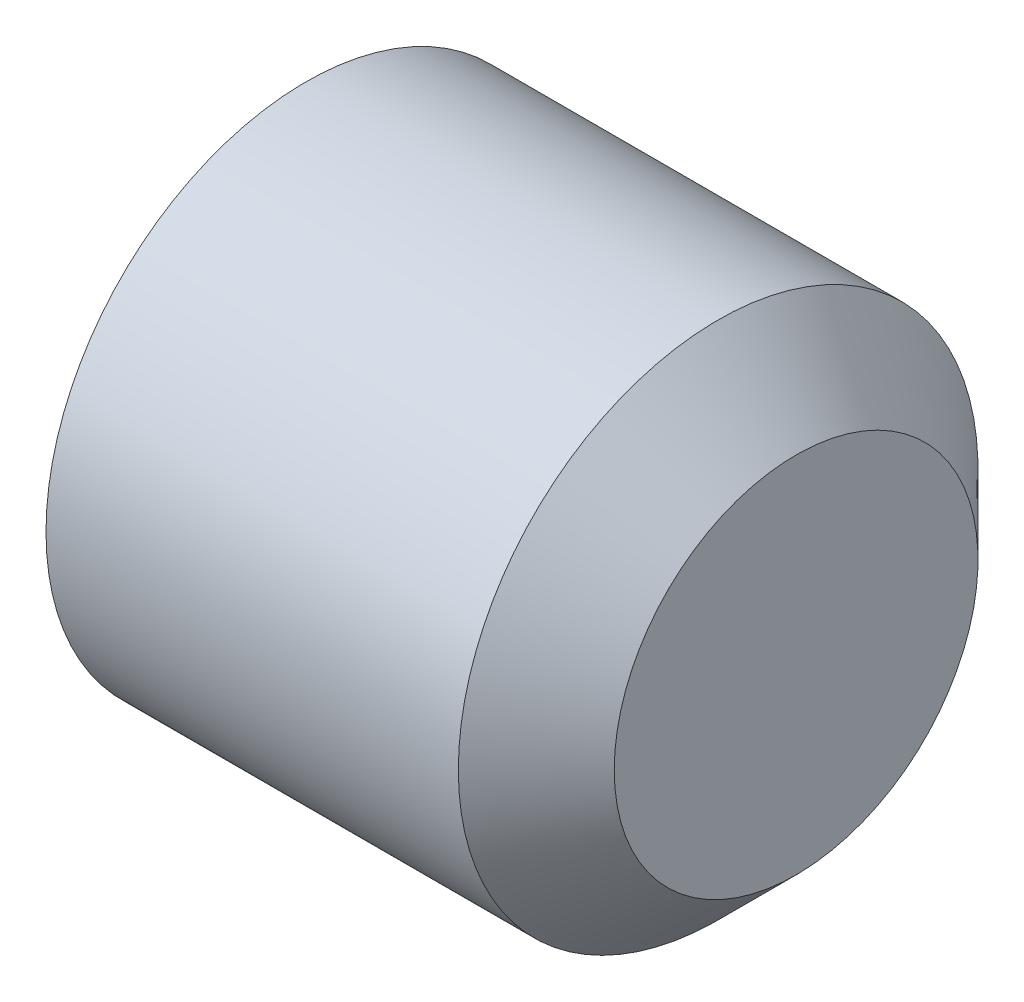
from build123d import *

# Parameters (mm, degrees)
CUT_EXTRUDE1_DEPTH = 2


with BuildPart() as part:
    # Sketch1 → Revolve1 (revolve)
    with BuildSketch(Plane.XY, mode=Mode.PRIVATE) as revolve1_sk:
        Polygon((0, 0), (0, 1.75), (-0.75, 2.5), (-4.717098368, 2.5), (-5, 2.01), (-5, 0), align=None)
    revolve(revolve1_sk.sketch.rotate(Axis((-5, 0, 0), (1, 0, 0)), 90), axis=Axis((-5, 0, 0), (1, 0, 0)))

    # Sketch2 → Cut-Extrude1 (cut)
    with BuildSketch(Plane(origin=(-5, 0, 0), x_dir=(0, 0, -1), z_dir=(1, 0, 0))):
        Polygon((1.25, -0.721687836), (1.25, 0.721687836), (0, 1.443375673), (-1.25, 0.721687836), (-1.25, -0.721687836), (0, -1.443375673), align=None)
    extrude(amount=CUT_EXTRUDE1_DEPTH, mode=Mode.SUBTRACT)


solid = part.part
